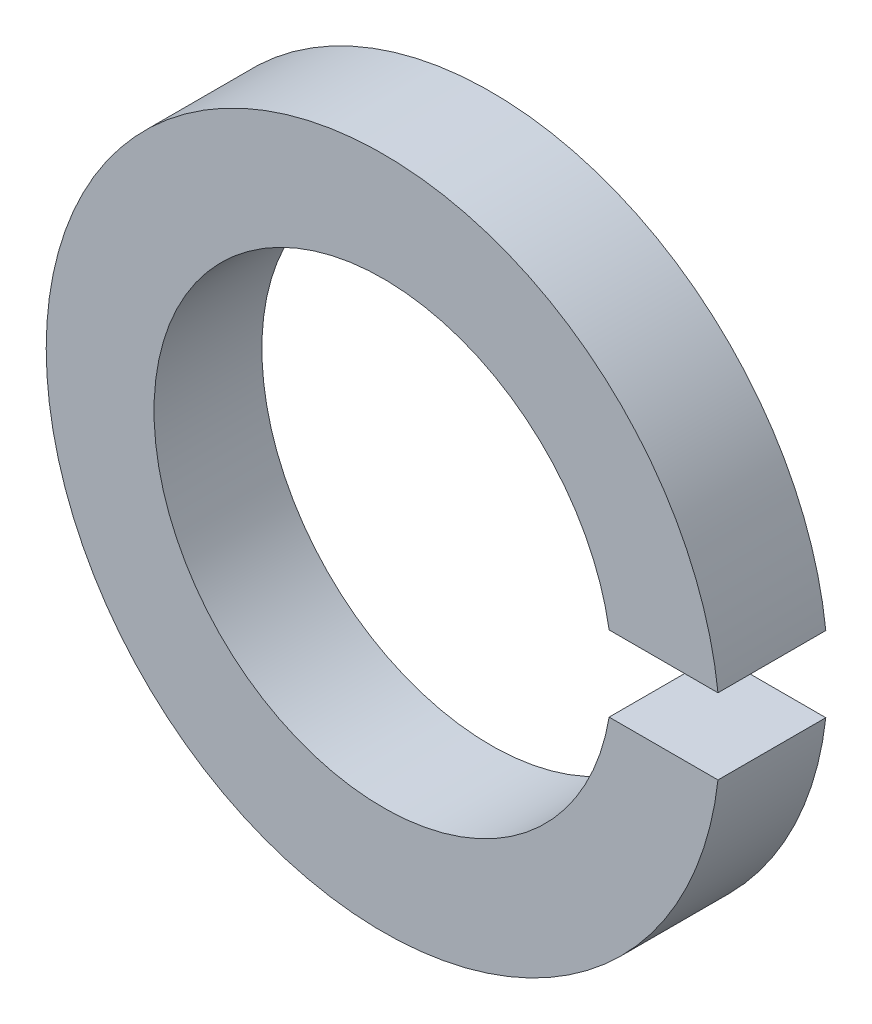
from build123d import *

# Parameters (mm, degrees)
SKETCH_1_R          = 3.75
SKETCH_1_R_2        = 2.55
EXTRUDE_1_DEPTH     = 1.2
SKETCH_2_W          = 1.400187421
SKETCH_2_H          = 0.84
CUT_EXTRUDE_1_DEPTH = 6.437370688


with BuildPart() as part:
    # Эскиз1 → Вытянуть1 (new body)
    with BuildSketch(Plane.XY):
        Circle(SKETCH_1_R)
        Circle(SKETCH_1_R_2, mode=Mode.SUBTRACT)
    extrude(amount=EXTRUDE_1_DEPTH)

    # Эскиз2 → Вырез-Вытянуть1 (cut, through all)
    with BuildSketch(Plane.XY.offset(1.2)):
        with Locations((3.136336779, 0)):
            Rectangle(SKETCH_2_W, SKETCH_2_H)
    extrude(amount=-CUT_EXTRUDE_1_DEPTH, mode=Mode.SUBTRACT)


solid = part.part
